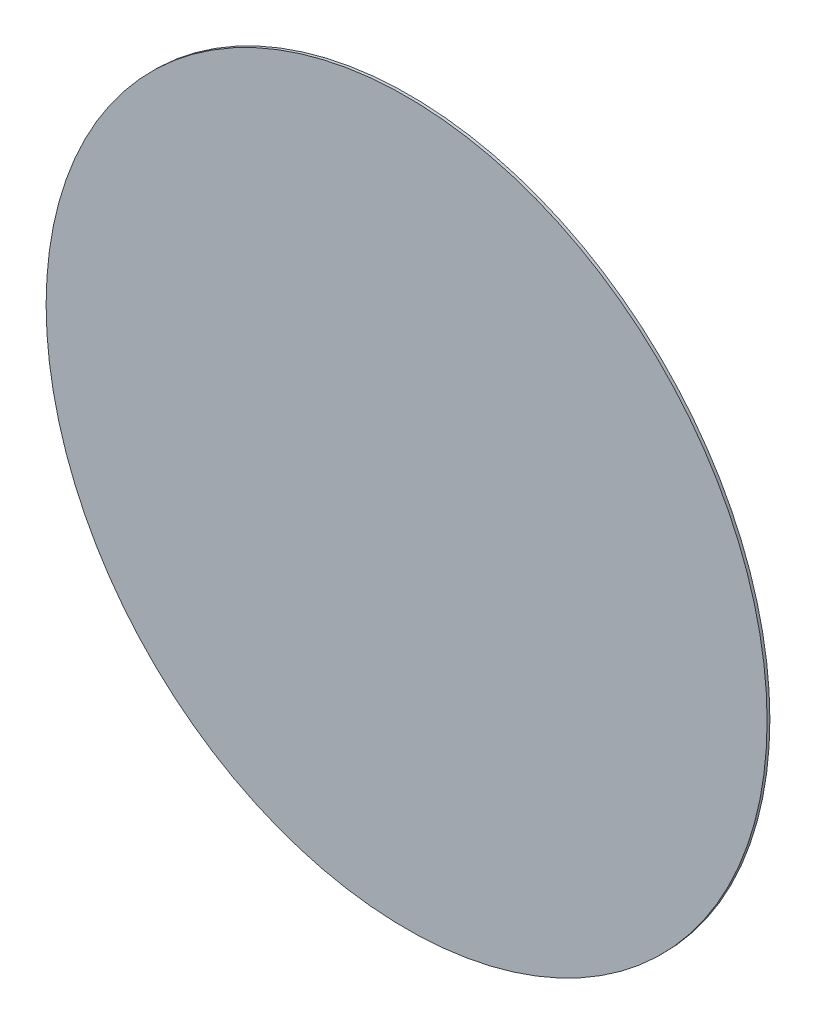
from build123d import *

# Parameters (mm, degrees)
SKETCH1_R      = 13
EXTRUDE1_DEPTH = 0.1


with BuildPart() as part:
    # Sketch1 → Extrude1 (new body)
    with BuildSketch(Plane.XY):
        Circle(SKETCH1_R)
    extrude(amount=EXTRUDE1_DEPTH)


solid = part.part
